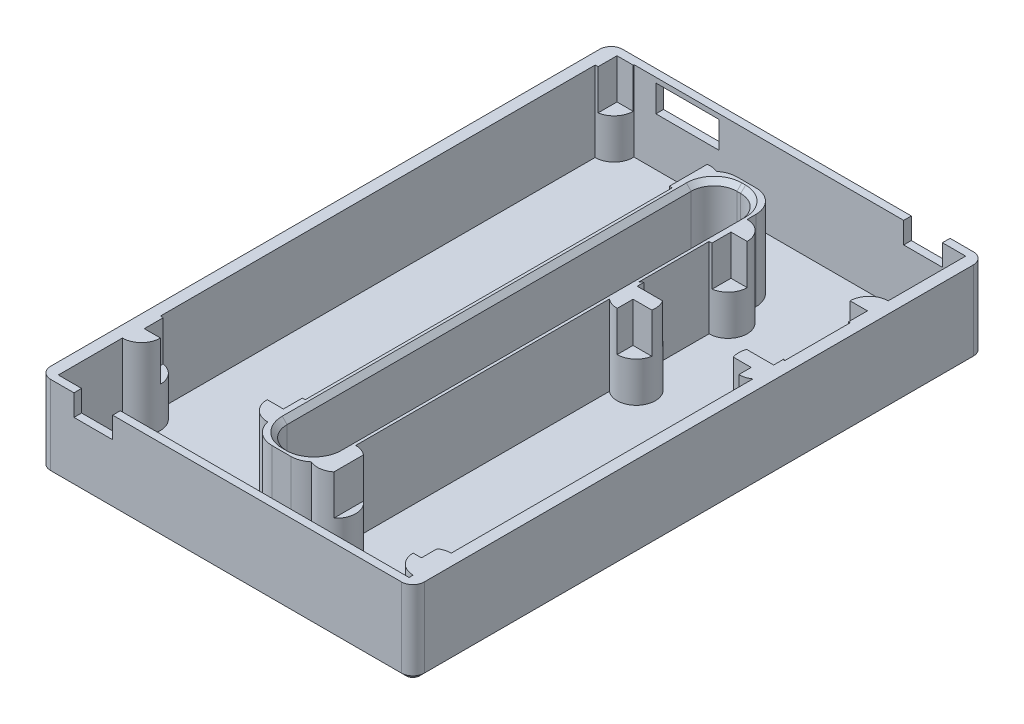
from build123d import *

# Parameters (mm, degrees)
BOSS_EXTRUDE1_DEPTH = 11
SKETCH8_W           = 46
SKETCH8_H           = 73
CUT_EXTRUDE1_DEPTH  = 10.5
BOSS_EXTRUDE2_START = 10.5
SKETCH9_R           = 2.5
BOSS_EXTRUDE2_DEPTH = 10.5
SKETCH10_W          = 15.5
SKETCH10_H          = 43.25
SKETCH10_W_2        = 17.9
SKETCH10_H_2        = 12.3
SKETCH10_W_3        = 18.25
SKETCH10_H_3        = 62
CUT_EXTRUDE3_DEPTH  = 5.25
SKETCH14_W          = 8.25
SKETCH14_H          = 3.5
CUT_EXTRUDE6_DEPTH  = 5
CUT_EXTRUDE7_REACH  = 81.663
SKETCH15_W          = 5.08
SKETCH15_H          = 2.794
CUT_EXTRUDE8_REACH  = 81.663
SKETCH16_W          = 5.08
SKETCH16_H          = 2.794
CHAMFER1_SIZE       = 0.635


with BuildPart() as part:
    # Sketch2 → Boss-Extrude1 (new body)
    with BuildSketch(Plane(origin=(0, 0, 0), x_dir=(1, 0, 0), z_dir=(0, 1, 0))):
        with BuildLine():
            Line((23, -37.5), (-23, -37.5))
            ThreePointArc((-23, -37.5), (-24.060660172, -37.060660172), (-24.5, -36))
            Line((-24.5, -36), (-24.5, 36))
            ThreePointArc((-24.5, 36), (-24.060660172, 37.060660172), (-23, 37.5))
            Line((-23, 37.5), (23, 37.5))
            ThreePointArc((23, 37.5), (24.060660172, 37.060660172), (24.5, 36))
            Line((24.5, 36), (24.5, -36))
            ThreePointArc((24.5, -36), (24.060660172, -37.060660172), (23, -37.5))
        make_face()
        with BuildLine():
            Line((0, 29.5), (0.5, 29.5))
            ThreePointArc((0.5, 29.5), (2.621320344, 28.621320344), (3.5, 26.5))
            Line((3.5, 26.5), (3.5, -26.5))
            ThreePointArc((3.5, -26.5), (2.621320344, -28.621320344), (0.5, -29.5))
            Line((0.5, -29.5), (0, -29.5))
            ThreePointArc((0, -29.5), (-2.121320344, -28.621320344), (-3, -26.5))
            Line((-3, -26.5), (-3, 26.5))
            ThreePointArc((-3, 26.5), (-2.121320344, 28.621320344), (0, 29.5))
        make_face(mode=Mode.SUBTRACT)
    extrude(amount=-BOSS_EXTRUDE1_DEPTH)

    # Sketch8 → Cut-Extrude1 (cut)
    # profile 1 of 2: a face of its own
    with BuildSketch(Plane(origin=(0, 0, 0), x_dir=(1, 0, 0), z_dir=(0, 1, 0))):
        Rectangle(SKETCH8_W, SKETCH8_H)
        with BuildLine():
            Line((-1, 30.5), (1.5, 30.5))
            ThreePointArc((1.5, 30.5), (3.621320344, 29.621320344), (4.5, 27.5))
            Line((4.5, 27.5), (4.5, -27.5))
            ThreePointArc((4.5, -27.5), (3.621320344, -29.621320344), (1.5, -30.5))
            Line((1.5, -30.5), (-1, -30.5))
            ThreePointArc((-1, -30.5), (-3.121320344, -29.621320344), (-4, -27.5))
            Line((-4, -27.5), (-4, 27.5))
            ThreePointArc((-4, 27.5), (-3.121320344, 29.621320344), (-1, 30.5))
        make_face(mode=Mode.SUBTRACT)
    # profile 2 of 2: a face of its own
    with BuildSketch(Plane(origin=(0, 0, 0), x_dir=(1, 0, 0), z_dir=(0, 1, 0))):
        with BuildLine():
            Line((0, 29.5), (0.5, 29.5))
            ThreePointArc((0.5, 29.5), (2.621320344, 28.621320344), (3.5, 26.5))
            Line((3.5, 26.5), (3.5, -26.5))
            ThreePointArc((3.5, -26.5), (2.621320344, -28.621320344), (0.5, -29.5))
            Line((0.5, -29.5), (0, -29.5))
            ThreePointArc((0, -29.5), (-2.121320344, -28.621320344), (-3, -26.5))
            Line((-3, -26.5), (-3, 26.5))
            ThreePointArc((-3, 26.5), (-2.121320344, 28.621320344), (0, 29.5))
        make_face()
    extrude(amount=-CUT_EXTRUDE1_DEPTH, mode=Mode.SUBTRACT)

    # Sketch9 → Boss-Extrude2 (add)
    with BuildSketch(Plane(origin=(0, -10.5, 0), x_dir=(1, 0, 0), z_dir=(0, 1, 0)).offset(BOSS_EXTRUDE2_START)):
        with Locations((21.58, 10.667919779)):
            Circle(SKETCH9_R)
        with Locations((6.08, 10.21529089)):
            Circle(SKETCH9_R)
        with BuildLine():
            Line((24.5, -35.456747529), (24.5, -31.456747529))
            ThreePointArc((24.5, -31.456747529), (20.5, -33.456747529), (24.5, -35.456747529))
        make_face()
        with BuildLine():
            Line((4.5, 26.342587088), (4.5, 21.342587088))
            ThreePointArc((4.5, 21.342587088), (7, 23.842587088), (4.5, 26.342587088))
        make_face()
        with BuildLine():
            Line((-4, 27.5), (-4, 25))
            ThreePointArc((-4, 25), (-6.442500859, 28.033094319), (-2.958333333, 29.772648357))
            ThreePointArc((-2.958333333, 29.772648357), (-3.727178029, 28.75), (-4, 27.5))
        make_face()
        with BuildLine():
            Line((-24.5, -27.605307327), (-24.5, -23.605307327))
            ThreePointArc((-24.5, -23.605307327), (-20.5, -25.605307327), (-24.5, -27.605307327))
        make_face()
        with BuildLine():
            Line((-20.757613835, 37.5), (-23, 37.5))
            ThreePointArc((-23, 37.5), (-24.060660172, 37.060660172), (-24.5, 36))
            Line((-24.5, 36), (-24.5, 34.394692673))
            ThreePointArc((-24.5, 34.394692673), (-21.40359225, 34.470769001), (-20.757613835, 37.5))
        make_face()
        with BuildLine():
            Line((24.5, 21.842587088), (24.5, 25.842587088))
            ThreePointArc((24.5, 25.842587088), (20.5, 23.842587088), (24.5, 21.842587088))
        make_face()
        with BuildLine():
            Line((-4, -23.105307327), (-4, -27.5))
            ThreePointArc((-4, -27.5), (-3.984574172, -27.803837144), (-3.938455326, -28.104549663))
            ThreePointArc((-3.938455326, -28.104549663), (-6.499810577, -25.636081995), (-4, -23.105307327))
        make_face()
        with BuildLine():
            Line((4.5, -25), (4.5, -27.5))
            ThreePointArc((4.5, -27.5), (4.227178029, -28.75), (3.458333333, -29.772648357))
            ThreePointArc((3.458333333, -29.772648357), (6.942500859, -28.033094319), (4.5, -25))
        make_face()
    extrude(amount=-BOSS_EXTRUDE2_DEPTH)

    # Sketch10 → Cut-Extrude3 (cut)
    with BuildSketch(Plane(origin=(0, -5.25, 0), x_dir=(1, 0, 0), z_dir=(0, 1, 0))):
        with Locations((13.83, -11.831747529)):
            Rectangle(SKETCH10_W, SKETCH10_H)
        with Locations((13.825, 17.692587088)):
            Rectangle(SKETCH10_W_2, SKETCH10_H_2)
        with Locations((-13.5, 5.394692673)):
            Rectangle(SKETCH10_W_3, SKETCH10_H_3)
    extrude(amount=CUT_EXTRUDE3_DEPTH, mode=Mode.SUBTRACT)

    # Sketch14 → Cut-Extrude6 (cut)
    with BuildSketch(Plane.XY.offset(-36.5)):
        with Locations((-13.5, -2.4)):
            Rectangle(SKETCH14_W, SKETCH14_H)
    extrude(amount=-CUT_EXTRUDE6_DEPTH, mode=Mode.SUBTRACT)

    # Sketch15 → Cut-Extrude7 (cut, up to next)
    with BuildSketch(Plane(origin=(0, 0, -37.5), x_dir=(-1, 0, 0), z_dir=(0, 0, -1)), mode=Mode.PRIVATE) as cut_extrude7_sk1:
        with Locations((-17.412, -1.397)):
            Rectangle(SKETCH15_W, SKETCH15_H)
    cut_extrude7_tool1 = extrude(cut_extrude7_sk1.sketch, amount=-CUT_EXTRUDE7_REACH, mode=Mode.PRIVATE) & part.part
    add(cut_extrude7_tool1.solids().sort_by_distance((17.412, -1.397, -37.5))[0], mode=Mode.SUBTRACT)

    # Sketch16 → Cut-Extrude8 (cut, up to next)
    with BuildSketch(Plane.XY.offset(37.5), mode=Mode.PRIVATE) as cut_extrude8_sk1:
        with Locations((-17.412, -1.397)):
            Rectangle(SKETCH16_W, SKETCH16_H)
    cut_extrude8_tool1 = extrude(cut_extrude8_sk1.sketch, amount=-CUT_EXTRUDE8_REACH, mode=Mode.PRIVATE) & part.part
    add(cut_extrude8_tool1.solids().sort_by_distance((-17.412, -1.397, 37.5))[0], mode=Mode.SUBTRACT)

    # Chamfer1
    chamfer1_edges = [part.edges().sort_by_distance(p)[0] for p in [
        (-24.060660172, -11, -37.060660172),
        (-24.5, -11, 0),
        (-2.121320344, 0, -28.621320344),
        (-3, 0, 0),
        (-2.121320344, 0, 28.621320344),
        (0.25, 0, 29.5),
        (2.621320344, 0, 28.621320344),
        (3.5, 0, 0),
        (-24.060660172, -11, 37.060660172),
        (2.621320344, 0, -28.621320344),
        (0.25, 0, -29.5),
        (0, -11, 37.5),
        (24.060660172, -11, 37.060660172),
        (24.5, -11, 0),
        (24.060660172, -11, -37.060660172),
        (0.25, -11, -29.5),
        (2.621320344, -11, -28.621320344),
        (3.5, -11, 0),
        (0, -11, -37.5),
        (2.621320344, -11, 28.621320344),
        (0.25, -11, 29.5),
        (-2.121320344, -11, 28.621320344),
        (-3, -11, 0),
        (-2.121320344, -11, -28.621320344),
    ]]
    chamfer(chamfer1_edges, length=CHAMFER1_SIZE)


solid = part.part
